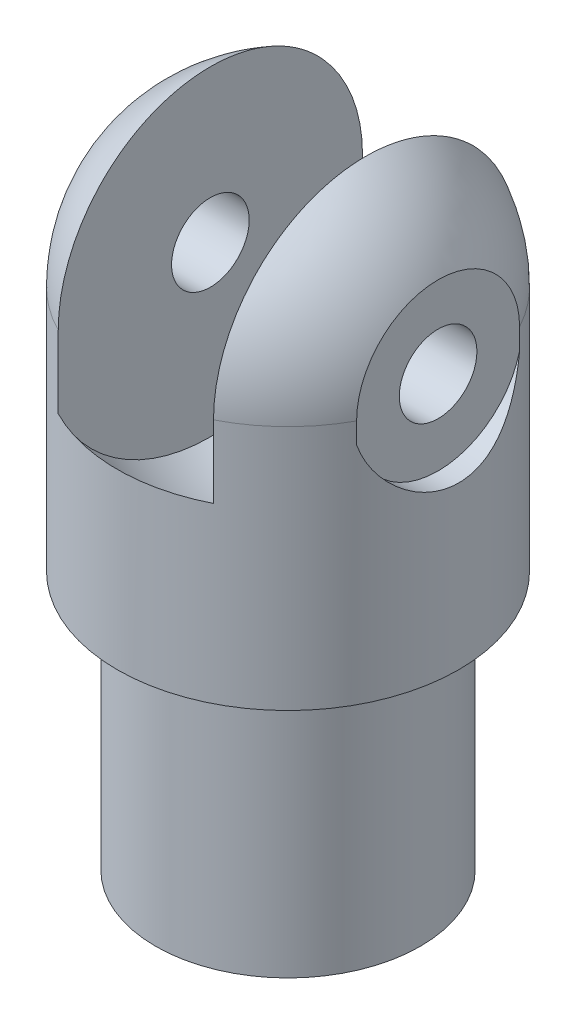
from build123d import *

# Parameters (mm, degrees)
SKETCH1_R               = 12.9921
BOSS_EXTRUDE1_DEPTH     = 25.4
CUT_EXTRUDE1_DEPTH      = 71.405666164
CUT_EXTRUDE1_DEPTH_BACK = 71.405666164
SKETCH3_R               = 3.81
SKETCH6_R               = 8.255
CUT_EXTRUDE2_DEPTH      = 2.032


with BuildPart() as part:
    # Sketch1 → Boss-Extrude1 (new body)
    with BuildSketch(Plane(origin=(0, 0, 0), x_dir=(1, 0, 0), z_dir=(0, 1, 0))):
        with Locations(Location((0, 0, 0), (0, 0, 270))):
            Circle(SKETCH1_R)
    extrude(amount=BOSS_EXTRUDE1_DEPTH)

    # Sketch2 → Revolve1 (revolve)
    with BuildSketch(Plane(origin=(0, 0, 0), x_dir=(0, 0, -1), z_dir=(1, 0, 0))):
        with BuildLine():
            Line((-16.764, 25.4), (-16.764, 49.53))
            ThreePointArc((-16.764, 49.53), (-11.85393808, 61.38393808), (0, 66.294))
            Line((0, 66.294), (0, 25.4))
            Line((0, 25.4), (-16.764, 25.4))
        make_face()
    revolve(axis=Axis((0, 25.4, 0), (0, 1, 0)))

    # Sketch3 → Cut-Extrude1 (cut, two sides: drawn at the far end of the back side and taken through both)
    with BuildSketch(Plane(origin=(0, 0, 0), x_dir=(0, 0, -1), z_dir=(1, 0, 0)).offset(-CUT_EXTRUDE1_DEPTH_BACK)):
        with Locations((0, 49.53)):
            Circle(SKETCH3_R)
    extrude(amount=CUT_EXTRUDE1_DEPTH + CUT_EXTRUDE1_DEPTH_BACK, mode=Mode.SUBTRACT)

    # Sketch4 → Cut-Revolve1 (revolve, cut)
    with BuildSketch(Plane.XY, mode=Mode.PRIVATE) as cut_revolve1_sk:
        with BuildLine():
            Line((-7.62, 32.995439638), (-7.62, 49.53))
            Line((-7.62, 49.53), (7.62, 49.53))
            Line((7.62, 49.53), (7.62, 32.995439638))
            ThreePointArc((7.62, 32.995439638), (0, 31.32406453), (-7.62, 32.995439638))
        make_face()
    revolve(cut_revolve1_sk.sketch.rotate(Axis((-7.62, 49.53, 0), (1, 0, 0)), 90), axis=Axis((-7.62, 49.53, 0), (1, 0, 0)), mode=Mode.SUBTRACT)

    # Sketch6 → Cut-Extrude2 (cut)
    with BuildSketch(Plane(origin=(16.764, 0, 0), x_dir=(0, 0, -1), z_dir=(1, 0, 0))):
        with Locations((0, 49.53)):
            Circle(SKETCH6_R)
    cut_extrude2 = extrude(amount=-CUT_EXTRUDE2_DEPTH, mode=Mode.SUBTRACT)

    # Mirror1: Cut-Extrude2 across plane
    add(cut_extrude2.mirror(Plane(origin=(0, 0, 0), x_dir=(0, 0, 1), z_dir=(1, 0, 0))), mode=Mode.SUBTRACT)


solid = part.part
